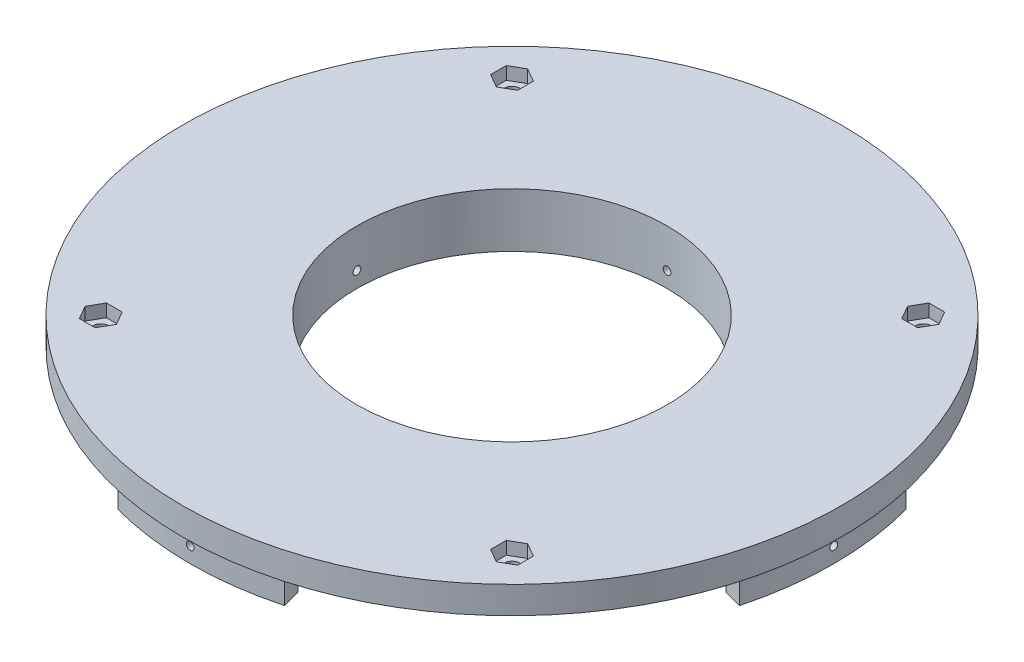
from build123d import *

# Parameters (mm, degrees)
SKETCH1_R           = 85
SKETCH1_R_2         = 40
BOSS_EXTRUDE1_DEPTH = 7
BOSS_EXTRUDE2_START = 7
SKETCH11_R          = 45
SKETCH11_R_2        = 40
BOSS_EXTRUDE2_DEPTH = 7
CUT_EXTRUDE1_START  = -133
SKETCH13_R          = 1
CUT_EXTRUDE1_DEPTH  = 243
SKETCH14_R          = 2
CUT_EXTRUDE2_DEPTH  = 133
CUT_EXTRUDE3_DEPTH  = 3.3
CIRPATTERN1_COUNT   = 2
CIRPATTERN1_ANGLE   = 90


with BuildPart() as part:
    # Sketch1 → Boss-Extrude1 (new body)
    with BuildSketch(Plane(origin=(0, 0, 0), x_dir=(1, 0, 0), z_dir=(0, 1, 0))):
        Circle(SKETCH1_R)
        Circle(SKETCH1_R_2, mode=Mode.SUBTRACT)
    extrude(amount=BOSS_EXTRUDE1_DEPTH)

    # Sketch11 → Boss-Extrude2 (add)
    # profile 1 of 5: a face of its own
    with BuildSketch(Plane.XZ.offset(BOSS_EXTRUDE2_START)):
        Circle(SKETCH11_R)
        Circle(SKETCH11_R_2, mode=Mode.SUBTRACT)
    # profile 2 of 5: a face of its own
    with BuildSketch(Plane.XZ.offset(BOSS_EXTRUDE2_START)):
        with BuildLine():
            Line((75.342214451, 20.187885518), (80.171843582, 21.481980744))
            ThreePointArc((80.171843582, 21.481980744), (83, 0), (80.171843582, -21.481980744))
            Line((80.171843582, -21.481980744), (75.342214451, -20.187885518))
            ThreePointArc((75.342214451, -20.187885518), (78, 0), (75.342214451, 20.187885518))
        make_face()
    # profile 3 of 5: a face of its own
    with BuildSketch(Plane.XZ.offset(BOSS_EXTRUDE2_START)):
        with BuildLine():
            Line((20.187885518, -75.342214451), (21.481980744, -80.171843582))
            ThreePointArc((21.481980744, -80.171843582), (0, -83), (-21.481980744, -80.171843582))
            Line((-21.481980744, -80.171843582), (-20.187885518, -75.342214451))
            ThreePointArc((-20.187885518, -75.342214451), (0, -78), (20.187885518, -75.342214451))
        make_face()
    # profile 4 of 5: a face of its own
    with BuildSketch(Plane.XZ.offset(BOSS_EXTRUDE2_START)):
        with BuildLine():
            Line((-75.342214451, -20.187885518), (-80.171843582, -21.481980744))
            ThreePointArc((-80.171843582, -21.481980744), (-83, 0), (-80.171843582, 21.481980744))
            Line((-80.171843582, 21.481980744), (-75.342214451, 20.187885518))
            ThreePointArc((-75.342214451, 20.187885518), (-78, 0), (-75.342214451, -20.187885518))
        make_face()
    # profile 5 of 5: a face of its own
    with BuildSketch(Plane.XZ.offset(BOSS_EXTRUDE2_START)):
        with BuildLine():
            Line((-20.187885518, 75.342214451), (-21.481980744, 80.171843582))
            ThreePointArc((-21.481980744, 80.171843582), (0, 83), (21.481980744, 80.171843582))
            Line((21.481980744, 80.171843582), (20.187885518, 75.342214451))
            ThreePointArc((20.187885518, 75.342214451), (0, 78), (-20.187885518, 75.342214451))
        make_face()
    extrude(amount=-BOSS_EXTRUDE2_DEPTH)

    # Sketch13 → Cut-Extrude1 (cut)
    with BuildSketch(Plane(origin=(0, 0, 0), x_dir=(0, 0, -1), z_dir=(1, 0, 0)).offset(CUT_EXTRUDE1_START)):
        with Locations((0, -3)):
            Circle(SKETCH13_R)
    cut_extrude1 = extrude(amount=CUT_EXTRUDE1_DEPTH, mode=Mode.SUBTRACT)

    # Sketch14 → Cut-Extrude2 (cut)
    with BuildSketch(Plane(origin=(0, 7, 0), x_dir=(1, 0, 0), z_dir=(0, 1, 0))):
        with Locations((-53.033008589, 53.033008589)):
            Circle(SKETCH14_R)
        with Locations((53.033008589, 53.033008589)):
            Circle(SKETCH14_R)
        with Locations((53.033008589, -53.033008589)):
            Circle(SKETCH14_R)
        with Locations((-53.033008589, -53.033008589)):
            Circle(SKETCH14_R)
    extrude(amount=-CUT_EXTRUDE2_DEPTH, mode=Mode.SUBTRACT)

    # Sketch15 → Cut-Extrude3 (cut)
    with BuildSketch(Plane(origin=(0, 7, 0), x_dir=(1, 0, 0), z_dir=(0, 1, 0))):
        Polygon((-49.533008589, 55.053734531), (-53.033008589, 57.074460473), (-56.533008589, 55.053734531), (-56.533008589, 51.012282647), (-53.033008589, 48.991556705), (-49.533008589, 51.012282647), align=None)
        Polygon((55.053734531, 49.533008589), (57.074460473, 53.033008589), (55.053734531, 56.533008589), (51.012282647, 56.533008589), (48.991556705, 53.033008589), (51.012282647, 49.533008589), align=None)
        Polygon((49.533008589, -55.053734531), (53.033008589, -57.074460473), (56.533008589, -55.053734531), (56.533008589, -51.012282647), (53.033008589, -48.991556705), (49.533008589, -51.012282647), align=None)
        Polygon((-55.053734531, -49.533008589), (-57.074460473, -53.033008589), (-55.053734531, -56.533008589), (-51.012282647, -56.533008589), (-48.991556705, -53.033008589), (-51.012282647, -49.533008589), align=None)
    extrude(amount=-CUT_EXTRUDE3_DEPTH, mode=Mode.SUBTRACT)

    # CirPattern1: Cut-Extrude1 ×2 about axis
    cirpattern1_axis = Axis((0, 7, 0), (0, 1, 0))
    for i in range(1, CIRPATTERN1_COUNT):
        add(cut_extrude1.rotate(cirpattern1_axis, i * CIRPATTERN1_ANGLE / (CIRPATTERN1_COUNT - 1)), mode=Mode.SUBTRACT)


solid = part.part
